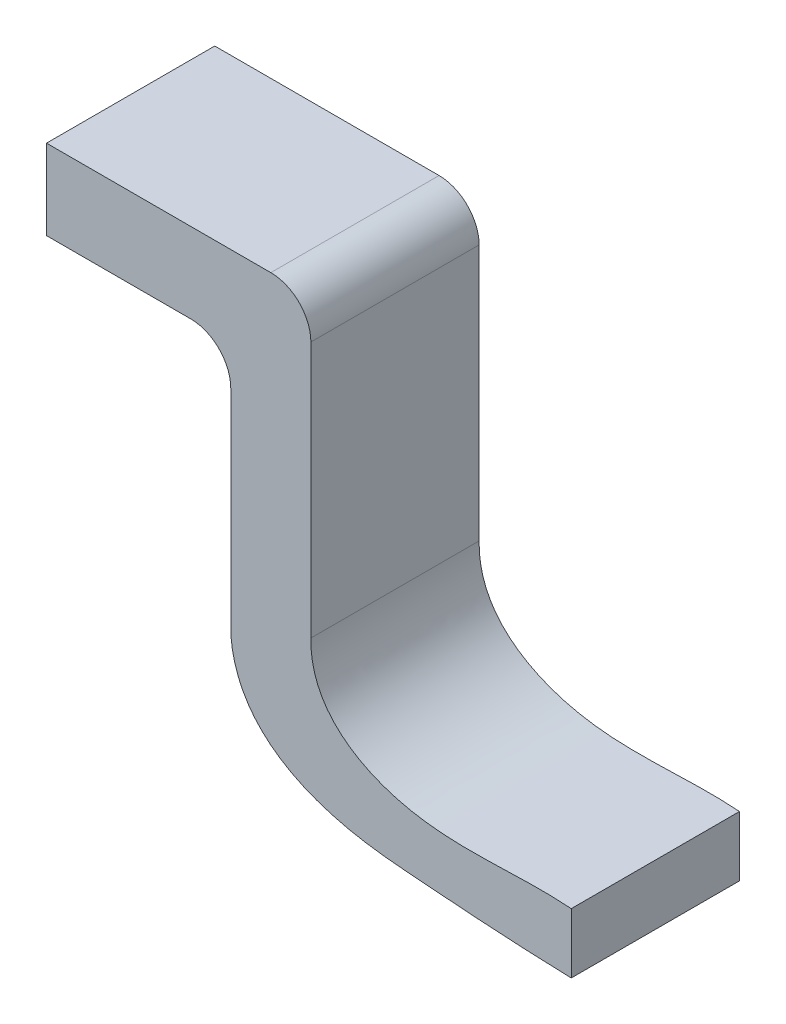
from build123d import *

# Parameters (mm, degrees)
BOSS_EXTRUDE1_DEPTH = 0.42


with BuildPart() as part:
    # Sketch1 → Boss-Extrude1 (new body)
    with BuildSketch(Plane.XY):
        with BuildLine():
            Line((0, 1.15), (0, 0.95))
            Line((0, 0.95), (0.36, 0.95))
            ThreePointArc((0.36, 0.95), (0.430710678, 0.920710678), (0.46, 0.85))
            Line((0.46, 0.85), (0.46, 0.317796194))
            add(Edge.make_bspline(
                [(0.46, 0.317796194), (0.474880606, 0.134638656), (0.690978233, 0.044183094), (0.947584463, 0.019140746), (1.192436941, 0.002848408), (1.31, 0)],
                knots=[0, 0, 0, 0, 0.373086953, 0.499546573, 0.782662078, 0.782662078, 0.782662078, 0.782662078], degree=3))
            Line((1.31, 0), (1.31, 0.15))
            add(Edge.make_bspline(
                [(0.66, 0.410010409), (0.657020771, 0.26558954), (0.908391178, 0.109635419), (1.170992072, 0.160633721), (1.31, 0.15)],
                knots=[0, 0, 0, 0, 0.461377354, 1, 1, 1, 1], degree=3))
            Line((0.66, 0.410010409), (0.66, 1.05))
            ThreePointArc((0.66, 1.05), (0.630710678, 1.120710678), (0.56, 1.15))
            Line((0.56, 1.15), (0, 1.15))
        make_face()
    extrude(amount=BOSS_EXTRUDE1_DEPTH)


solid = part.part
